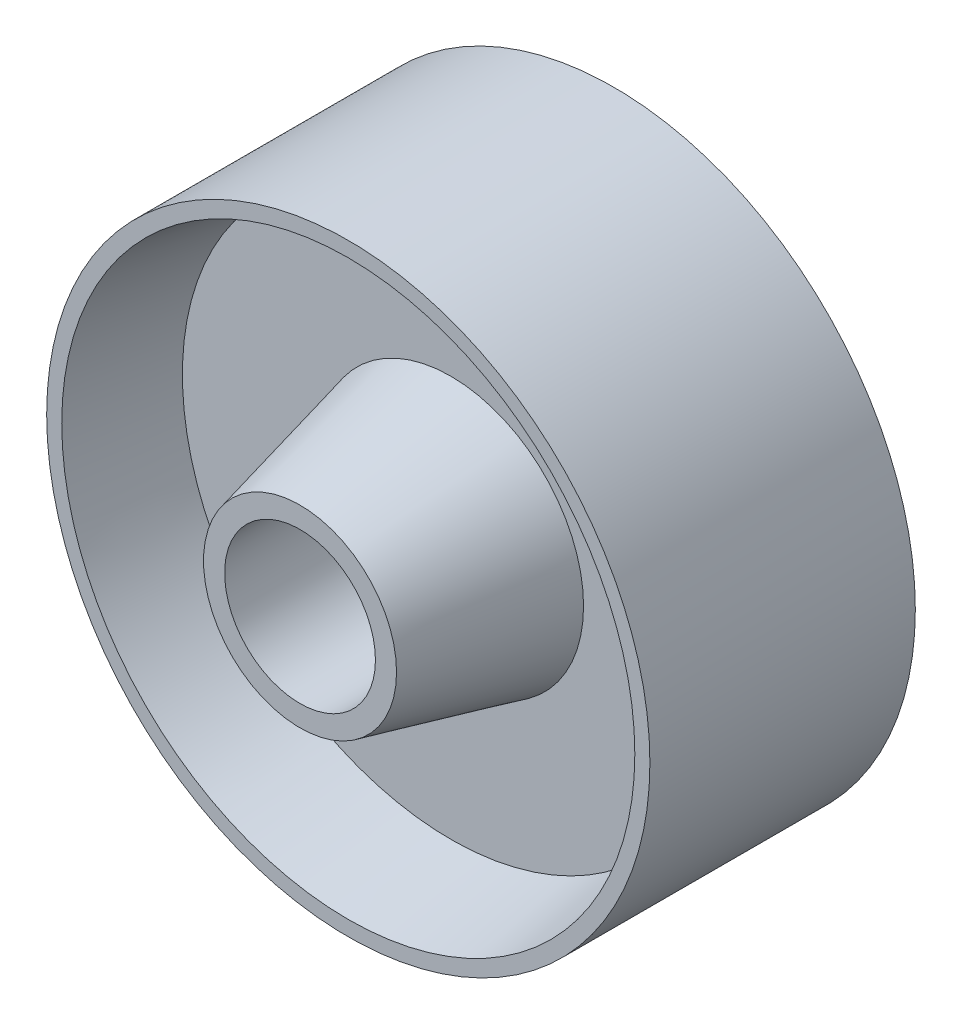
from build123d import *


with BuildPart() as part:
    # Sketch1 → Revolve1 (revolve)
    with BuildSketch(Plane(origin=(0, 0, 0), x_dir=(0, 0, -1), z_dir=(1, 0, 0)), mode=Mode.PRIVATE) as revolve1_sk:
        Polygon((-30, 0), (30, 0), (30, 3.5), (5, 9.5), (5, 32), (22, 35), (22, 37.5), (-22, 37.5), (-22, 35), (-5, 32), (-5, 9.5), (-30, 3.5), align=None)
    revolve(revolve1_sk.sketch.rotate(Axis((0, -12.5, 51.664567411), (0, 0, -1)), 90), axis=Axis((0, -12.5, 51.664567411), (0, 0, -1)))


solid = part.part
